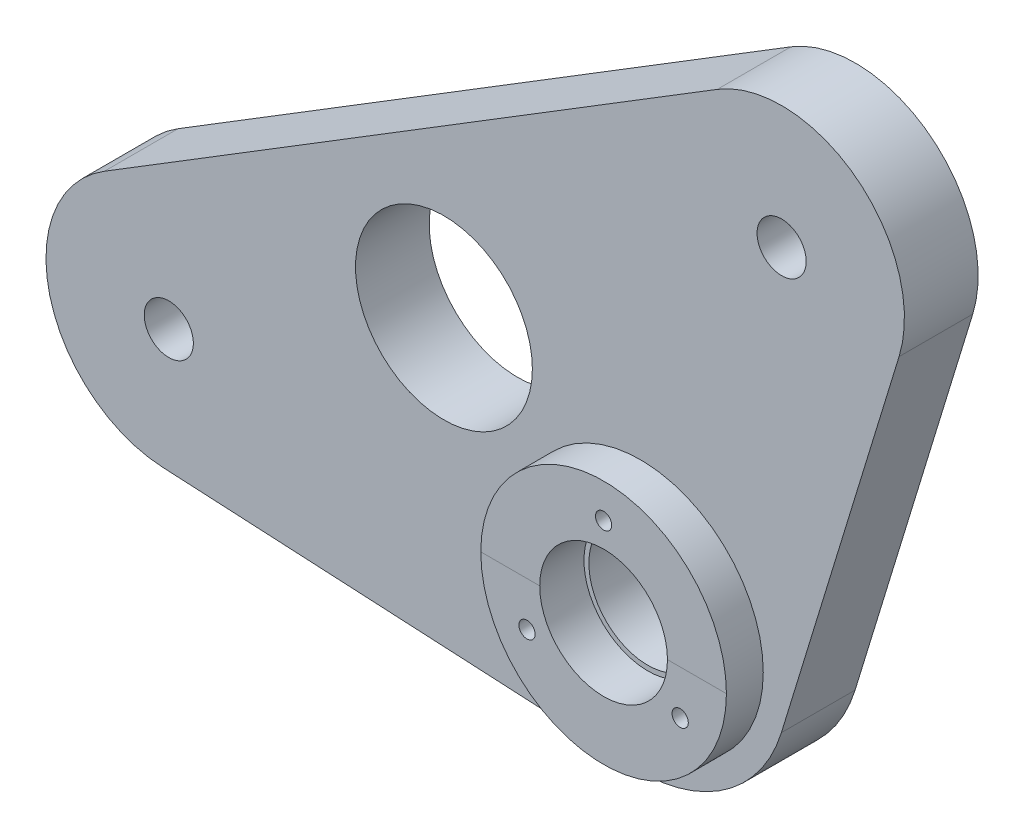
from build123d import *

# Parameters (mm, degrees)
BASELINE_BODY_DEPTH          = 7.5
SKETCH3_R                    = 5
CUT_EXTRUDE1_DEPTH           = 159.837149307
SKETCH4_R                    = 25
BOSS_EXTRUDE2_DEPTH          = 15
SKETCH5_R                    = 12
CUT_EXTRUDE2_DEPTH           = 161.947941894
SKETCH6_R                    = 13
CUT_EXTRUDE3_DEPTH           = 9
CUT_EXTRUDE4_START           = -9
SKETCH7_R                    = 13
CUT_EXTRUDE4_DEPTH           = 9
M4_TAPPED_HOLE6_D            = 3.3
M4_TAPPED_HOLE6_DEPTH        = 9
M4_TAPPED_HOLE6_TIP          = 0.991420021
M4_TAPPED_HOLE8_D            = 3.3
M4_TAPPED_HOLE8_DEPTH        = 9
M4_TAPPED_HOLE8_TIP          = 0.991420021
LIGHTENING_WINDOW_DEPTH      = 160.720036314
LIGHTENING_WINDOW_DEPTH_BACK = 160.720036314
SKETCH17_R                   = 18


with BuildPart() as part:
    # Rocker_Profile → Baseline_Body (new, symmetric)
    with BuildSketch(Plane.XY):
        with BuildLine():
            Line((-97.302083333, -24.966068553), (-1.5625, -29.959282264))
            ThreePointArc((-1.5625, -29.959282264), (17.206458335, -24.57514581), (28.686326507, -8.780357142))
            Line((28.686326507, -8.780357142), (52.641312178, 69.483035715))
            ThreePointArc((52.641312178, 69.483035715), (44.023831603, 96.580885487), (15.628732451, 98.088458997))
            Line((15.628732451, 98.088458997), (-109.107307638, 21.288458997))
            ThreePointArc((-109.107307638, 21.288458997), (-120.2235003, -6.182397046), (-97.302083333, -24.966068553))
        make_face()
    extrude(amount=BASELINE_BODY_DEPTH, both=True)

    # Sketch3 → Cut-Extrude1 (cut, through all)
    with BuildSketch(Plane.XY.offset(7.5)):
        with Locations((-96, 0)):
            Circle(SKETCH3_R)
        with Locations((28.736040089, 76.8)):
            Circle(SKETCH3_R)
    extrude(amount=-CUT_EXTRUDE1_DEPTH, mode=Mode.SUBTRACT)

    # Sketch4 → Boss-Extrude2 (add, symmetric)
    with BuildSketch(Plane.XY):
        Circle(SKETCH4_R)
    extrude(amount=BOSS_EXTRUDE2_DEPTH, both=True)

    # Sketch5 → Cut-Extrude2 (cut, through all)
    with BuildSketch(Plane.XY.offset(15)):
        Circle(SKETCH5_R)
    extrude(amount=-CUT_EXTRUDE2_DEPTH, mode=Mode.SUBTRACT)

    # Sketch6 → Cut-Extrude3 (cut)
    with BuildSketch(Plane.XY.offset(15)):
        Circle(SKETCH6_R)
    extrude(amount=-CUT_EXTRUDE3_DEPTH, mode=Mode.SUBTRACT)

    # Sketch7 → Cut-Extrude4 (cut)
    with BuildSketch(Plane(origin=(0, 0, -15), x_dir=(-1, 0, 0), z_dir=(0, 0, -1)).offset(CUT_EXTRUDE4_START)):
        with Locations(Location((0, 0, 0), (0, 0, 180))):
            Circle(SKETCH7_R)
    extrude(amount=CUT_EXTRUDE4_DEPTH, mode=Mode.SUBTRACT)

    # M4 Tapped Hole6
    with Locations(Plane.XY.offset(15)):
        with Locations((-15.588457268, -9), (0, 18), (15.588457268, -9)):
            Hole(M4_TAPPED_HOLE6_D / 2, depth=M4_TAPPED_HOLE6_DEPTH)
            with Locations((0, 0, -(M4_TAPPED_HOLE6_DEPTH + M4_TAPPED_HOLE6_TIP / 2))):  # 118° drill point
                Cone(0, M4_TAPPED_HOLE6_D / 2, M4_TAPPED_HOLE6_TIP, mode=Mode.SUBTRACT)

    # M4 Tapped Hole8
    with Locations(Plane(origin=(0, 0, -15), x_dir=(-1, 0, 0), z_dir=(0, 0, -1))):
        with Locations((-15.588457268, -9), (0, 18), (15.585467422, -8.998273811)):
            Hole(M4_TAPPED_HOLE8_D / 2, depth=M4_TAPPED_HOLE8_DEPTH)
            with Locations((0, 0, -(M4_TAPPED_HOLE8_DEPTH + M4_TAPPED_HOLE8_TIP / 2))):  # 118° drill point
                Cone(0, M4_TAPPED_HOLE8_D / 2, M4_TAPPED_HOLE8_TIP, mode=Mode.SUBTRACT)

    # Sketch17 → Lightening_Window (cut, two sides: drawn at the far end of the back side and taken through both)
    with BuildSketch(Plane.XY.offset(7.5).offset(-LIGHTENING_WINDOW_DEPTH_BACK)):
        with Locations((-40, 30)):
            Circle(SKETCH17_R)
    extrude(amount=LIGHTENING_WINDOW_DEPTH + LIGHTENING_WINDOW_DEPTH_BACK, mode=Mode.SUBTRACT)


solid = part.part
